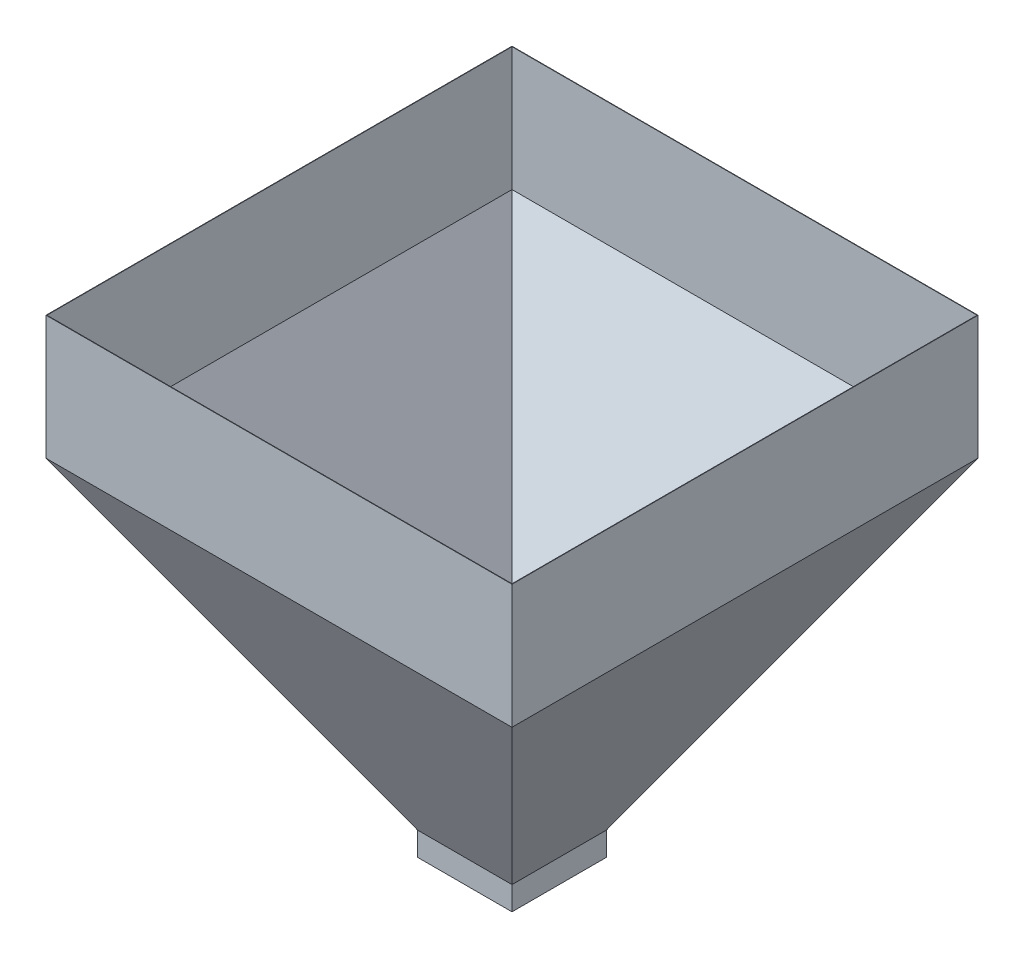
from build123d import *

# Parameters (mm, degrees)
CROQUIS3_W              = 790
CROQUIS3_H              = 790
SALIENTE_EXTRUIR1_DEPTH = 210
VACIADO2_T              = -0.76
CROQUIS5_W              = 160
CROQUIS5_H              = 160
CROQUIS5_W_2            = 158.245179758
CROQUIS5_H_2            = 158.245179758
SALIENTE_EXTRUIR2_DEPTH = 40


with BuildPart() as part:
    # Croquis1 → Recubrir1 section 0
    with BuildSketch(Plane(origin=(0, 0, 0), x_dir=(1, 0, 0), z_dir=(0, 1, 0))):
        with BuildLine():
            Line((-395, 395), (395, 395))
            Line((395, 395), (395, -395))
            Line((395, -395), (-395, -395))
            Line((-395, -395), (-395, 395))
        make_face()
    # Croquis2 → Recubrir1 section 1
    with BuildSketch(Plane(origin=(0, -546, 0), x_dir=(1, 0, 0), z_dir=(0, 1, 0))):
        with BuildLine():
            Line((-80, 80), (80, 80))
            Line((80, 80), (80, -80))
            Line((80, -80), (-80, -80))
            Line((-80, -80), (-80, 80))
        make_face()
    loft()

    # Croquis3 → Saliente-Extruir1 (add)
    with BuildSketch(Plane(origin=(0, 0, 0), x_dir=(1, 0, 0), z_dir=(0, 1, 0))):
        Rectangle(CROQUIS3_W, CROQUIS3_H)
    extrude(amount=SALIENTE_EXTRUIR1_DEPTH)

    # Vaciado2
    vaciado2_openings = [part.faces().sort_by_distance(p)[0] for p in [
        (0, -546, 0),
        (0, 210, 0),
    ]]
    offset(amount=VACIADO2_T, openings=vaciado2_openings)

    # Croquis5 → Saliente-Extruir2 (add)
    with BuildSketch(Plane.XZ.offset(546)):
        Rectangle(CROQUIS5_W, CROQUIS5_H)
        Rectangle(CROQUIS5_W_2, CROQUIS5_H_2, mode=Mode.SUBTRACT)
    extrude(amount=SALIENTE_EXTRUIR2_DEPTH)


solid = part.part
